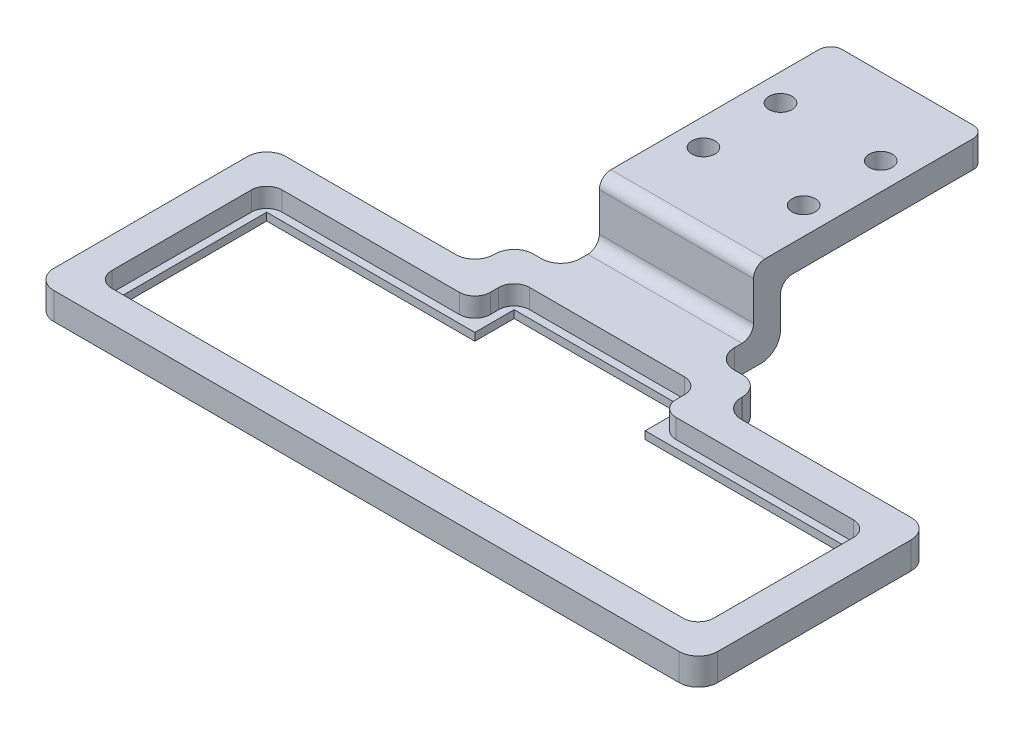
from build123d import *

# Parameters (mm, degrees)
RESSALTO_EXTRUS_O1_DEPTH      = 3.5
RESSALTO_EXTRUS_O2_DEPTH      = 1
RESSALTO_EXTRUS_O3_DEPTH      = 10
RESSALTO_EXTRUS_O3_DEPTH_BACK = 10
ESBO_O4_W                     = 26.5
ESBO_O4_H                     = 8
CORTE_EXTRUS_O1_DEPTH         = 7
CORTE_EXTRUS_O2_START         = -20
ESBO_O4_2_W                   = 26.5
ESBO_O4_2_H                   = 8
CORTE_EXTRUS_O2_DEPTH         = 7
CORTE_EXTRUS_O3_DEPTH         = 71.418925013
CORTE_EXTRUS_O3_DEPTH_BACK    = 71.418925013
ESBO_O5_R                     = 1.5
FILETE1_R                     = 2
FILETE2_R                     = 2.5
FILETE3_R                     = 1.5
CORTE_EXTRUS_O4_DEPTH         = 7
CORTE_EXTRUS_O5_START         = -13
CORTE_EXTRUS_O5_DEPTH         = 7


with BuildPart() as part:
    # Esboço1 → Ressalto-extrusão1 (new body)
    with BuildSketch(Plane(origin=(0, 0, 0), x_dir=(1, 0, 0), z_dir=(0, 1, 0))):
        Polygon((-16.05, 20.15), (16.05, 20.15), (16.05, 15.05), (43.05, 15.05), (43.05, -15.05), (-43.05, -15.05), (-43.05, 15.05), (-16.05, 15.05), align=None)
        Polygon((12.05, 11.05), (39.05, 11.05), (39.05, -11.05), (-39.05, -11.05), (-39.05, 11.05), (-12.05, 11.05), (-12.05, 16.15), (12.05, 16.15), align=None, mode=Mode.SUBTRACT)
    extrude(amount=RESSALTO_EXTRUS_O1_DEPTH)

    # Esboço2 → Ressalto-extrusão2 (add)
    with BuildSketch(Plane.XZ):
        Polygon((39.05, 11.05), (39.05, -11.05), (12.05, -11.05), (12.05, -16.15), (-12.05, -16.15), (-12.05, -11.05), (-39.05, -11.05), (-39.05, 11.05), align=None)
        Polygon((38.05, -10.05), (38.05, 10.05), (-38.05, 10.05), (-38.05, -10.05), (-11.05, -10.05), (-11.05, -15.15), (11.05, -15.15), (11.05, -10.05), align=None, mode=Mode.SUBTRACT)
    extrude(amount=-RESSALTO_EXTRUS_O2_DEPTH)

    # Esboço3 → Ressalto-extrusão3 (add, two sides: drawn at the far end of the back side and taken through both)
    with BuildSketch(Plane(origin=(0, 0, 0), x_dir=(0, 0, -1), z_dir=(1, 0, 0)).offset(-RESSALTO_EXTRUS_O3_DEPTH_BACK)):
        Polygon((20.15, 0), (28.65, 0), (55.15, 8), (55.15, 11.5), (25.15, 11.5), (25.15, 3.5), (20.15, 3.5), align=None)
        Polygon((28.65, 3.5), (43.55625, 8), (28.65, 8), align=None, mode=Mode.SUBTRACT)
    extrude(amount=RESSALTO_EXTRUS_O3_DEPTH + RESSALTO_EXTRUS_O3_DEPTH_BACK)

    # Esboço4 → Corte-extrusão1 (cut)
    with BuildSketch(Plane(origin=(10, 0, 0), x_dir=(0, 0, -1), z_dir=(1, 0, 0))):
        with Locations((41.9, 4)):
            Rectangle(ESBO_O4_W, ESBO_O4_H)
    extrude(amount=-CORTE_EXTRUS_O1_DEPTH, mode=Mode.SUBTRACT)

    # Esboço4<2> → Corte-extrusão2 (cut)
    with BuildSketch(Plane(origin=(10, 0, 0), x_dir=(0, 0, -1), z_dir=(1, 0, 0)).offset(CORTE_EXTRUS_O2_START)):
        with Locations((41.9, 4)):
            Rectangle(ESBO_O4_2_W, ESBO_O4_2_H)
    extrude(amount=CORTE_EXTRUS_O2_DEPTH, mode=Mode.SUBTRACT)

    # Esboço5 → Corte-extrusão3 (cut, two sides: drawn at the far end of the back side and taken through both)
    with BuildSketch(Plane.XZ.offset(-8).offset(-CORTE_EXTRUS_O3_DEPTH_BACK)):
        with Locations(Location((-6.5, -45.15, 0), (0, 0, 270))):
            Circle(ESBO_O5_R)
        with Locations(Location((6.5, -45.15, 0), (0, 0, 270))):
            Circle(ESBO_O5_R)
        with Locations(Location((-6.5, -35.15, 0), (0, 0, 270))):
            Circle(ESBO_O5_R)
        with Locations(Location((6.5, -35.15, 0), (0, 0, 270))):
            Circle(ESBO_O5_R)
    extrude(amount=CORTE_EXTRUS_O3_DEPTH + CORTE_EXTRUS_O3_DEPTH_BACK, mode=Mode.SUBTRACT)

    # Filete1
    filete1_edges = [part.edges().sort_by_distance(p)[0] for p in [
        (39.05, 2.25, 11.05),
        (39.05, 2.25, -11.05),
        (12.05, 2.25, -11.05),
        (12.05, 2.25, -16.15),
        (-12.05, 2.25, -16.15),
        (-12.05, 2.25, -11.05),
        (-39.05, 2.25, -11.05),
        (-39.05, 2.25, 11.05),
    ]]
    fillet(filete1_edges, radius=FILETE1_R)

    # Filete2
    filete2_edges = [part.edges().sort_by_distance(p)[0] for p in [
        (10, 1.75, -20.15),
        (-10, 1.75, -20.15),
        (-16.05, 1.75, -20.15),
        (16.05, 1.75, -20.15),
        (16.05, 1.75, -15.05),
        (43.05, 1.75, -15.05),
        (43.05, 1.75, 15.05),
        (-43.05, 1.75, 15.05),
        (-43.05, 1.75, -15.05),
        (-16.05, 1.75, -15.05),
    ]]
    fillet(filete2_edges, radius=FILETE2_R)

    # Filete3
    filete3_edges = [part.edges().sort_by_distance(p)[0] for p in [
        (10, 9.75, -55.15),
        (-10, 9.75, -55.15),
        (0, 11.5, -25.15),
        (0, 3.5, -25.15),
        (0, 8, -28.65),
        (0, 8, -43.55625),
        (0, 3.5, -28.65),
    ]]
    fillet(filete3_edges, radius=FILETE3_R)

    # Esboço6 → Corte-extrusão4 (cut)
    with BuildSketch(Plane(origin=(10, 0, 0), x_dir=(0, 0, -1), z_dir=(1, 0, 0))):
        with BuildLine():
            Line((26.15, 0), (28.65, 0))
            Line((28.65, 0), (28.65, 2.5))
            ThreePointArc((28.65, 2.5), (27.917766953, 0.732233047), (26.15, 0))
        make_face()
    extrude(amount=-CORTE_EXTRUS_O4_DEPTH, mode=Mode.SUBTRACT)

    # Esboço6<2> → Corte-extrusão5 (cut)
    with BuildSketch(Plane(origin=(10, 0, 0), x_dir=(0, 0, -1), z_dir=(1, 0, 0)).offset(CORTE_EXTRUS_O5_START)):
        with BuildLine():
            Line((26.15, 0), (28.65, 0))
            Line((28.65, 0), (28.65, 2.5))
            ThreePointArc((28.65, 2.5), (27.917766953, 0.732233047), (26.15, 0))
        make_face()
    extrude(amount=-CORTE_EXTRUS_O5_DEPTH, mode=Mode.SUBTRACT)


solid = part.part
